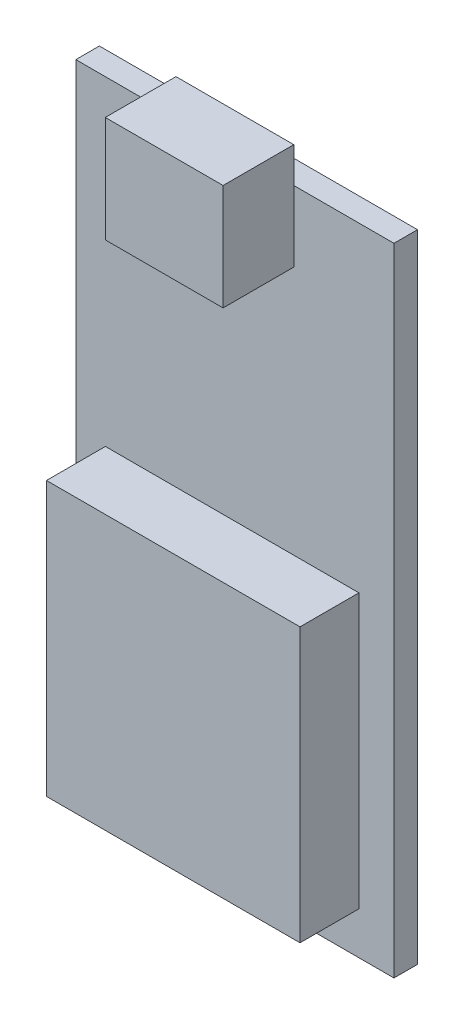
from build123d import *

# Parameters (mm, degrees)
SKETCH1_W           = 27
SKETCH1_H           = 54
BOSS_EXTRUDE1_DEPTH = 2
SKETCH2_W           = 21.516228829
SKETCH2_H           = 23.223866036
BOSS_EXTRUDE2_DEPTH = 5
SKETCH3_W           = 10
SKETCH3_H           = 9
BOSS_EXTRUDE3_DEPTH = 6


with BuildPart() as part:
    # Sketch1 → Boss-Extrude1 (new body)
    with BuildSketch(Plane.XY):
        with Locations((-80.639613313, 563.037909552)):
            Rectangle(SKETCH1_W, SKETCH1_H)
    extrude(amount=BOSS_EXTRUDE1_DEPTH)

    # Sketch2 → Boss-Extrude2 (add)
    with BuildSketch(Plane.XY.offset(2)):
        with Locations((-80.869725333, 551.250045653)):
            Rectangle(SKETCH2_W, SKETCH2_H)
    extrude(amount=BOSS_EXTRUDE2_DEPTH)

    # Sketch3 → Boss-Extrude3 (add)
    with BuildSketch(Plane.XY.offset(2)):
        with Locations((-80.639613313, 588.537909552)):
            Rectangle(SKETCH3_W, SKETCH3_H)
    extrude(amount=BOSS_EXTRUDE3_DEPTH)


solid = part.part
